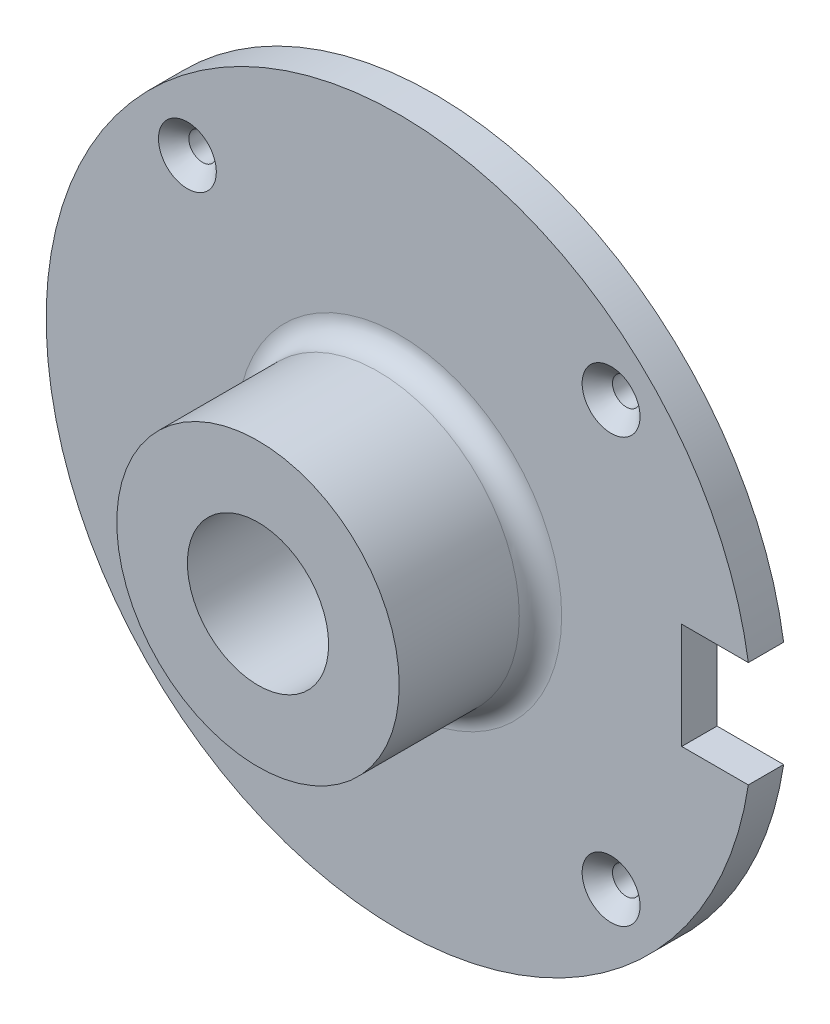
from build123d import *

# Parameters (mm, degrees)
SKETCH5_W                                         = 10
SKETCH5_H                                         = 15
EXTRUDE2_DEPTH                                    = 74.484692283
CSK_FOR_M3_5_FLAT_HEAD_MACHINE_SCREW1_D           = 3.9
CSK_FOR_M3_5_FLAT_HEAD_MACHINE_SCREW1_CSINK_D     = 8.2
CSK_FOR_M3_5_FLAT_HEAD_MACHINE_SCREW1_CSINK_ANGLE = 90
CIRPATTERN1_COUNT                                 = 4


with BuildPart() as part:
    # Sketch1 → Revolve1 (revolve)
    with BuildSketch(Plane(origin=(0, 0, 0), x_dir=(0, 0, -1), z_dir=(1, 0, 0)), mode=Mode.PRIVATE) as revolve1_sk:
        with BuildLine():
            Line((0, 10), (-25, 10))
            Line((-25, 10), (-25, 20))
            Line((-25, 20), (-8, 20))
            ThreePointArc((-8, 20), (-5.878679656, 20.878679656), (-5, 23))
            Line((-5, 23), (-5, 50))
            Line((-5, 50), (0, 50))
            Line((0, 50), (0, 10))
        make_face()
    revolve(revolve1_sk.sketch.rotate(Axis((0, 0, 50), (0, 0, -1)), 90), axis=Axis((0, 0, 50), (0, 0, -1)))

    # Sketch5 → Extrude2 (cut, through all)
    with BuildSketch(Plane.XY.offset(5)):
        with Locations((45, 0)):
            Rectangle(SKETCH5_W, SKETCH5_H)
    extrude(amount=-EXTRUDE2_DEPTH, mode=Mode.SUBTRACT)

    # CSK for M3.5 Flat Head Machine Screw1 (through all)
    with Locations(Plane.XY.offset(5)):
        with Locations((-30, 30)):
            csk_for_m3_5_flat_head_machine_screw1 = CounterSinkHole(CSK_FOR_M3_5_FLAT_HEAD_MACHINE_SCREW1_D / 2, CSK_FOR_M3_5_FLAT_HEAD_MACHINE_SCREW1_CSINK_D / 2, counter_sink_angle=CSK_FOR_M3_5_FLAT_HEAD_MACHINE_SCREW1_CSINK_ANGLE)

    # CirPattern1: CSK for M3.5 Flat Head Machine Screw1 ×4 about axis
    cirpattern1_axis = Axis((0, 0, 0), (0, 0, 1))
    for i in range(1, CIRPATTERN1_COUNT):
        add(csk_for_m3_5_flat_head_machine_screw1.rotate(cirpattern1_axis, i * 360 / CIRPATTERN1_COUNT), mode=Mode.SUBTRACT)


solid = part.part
